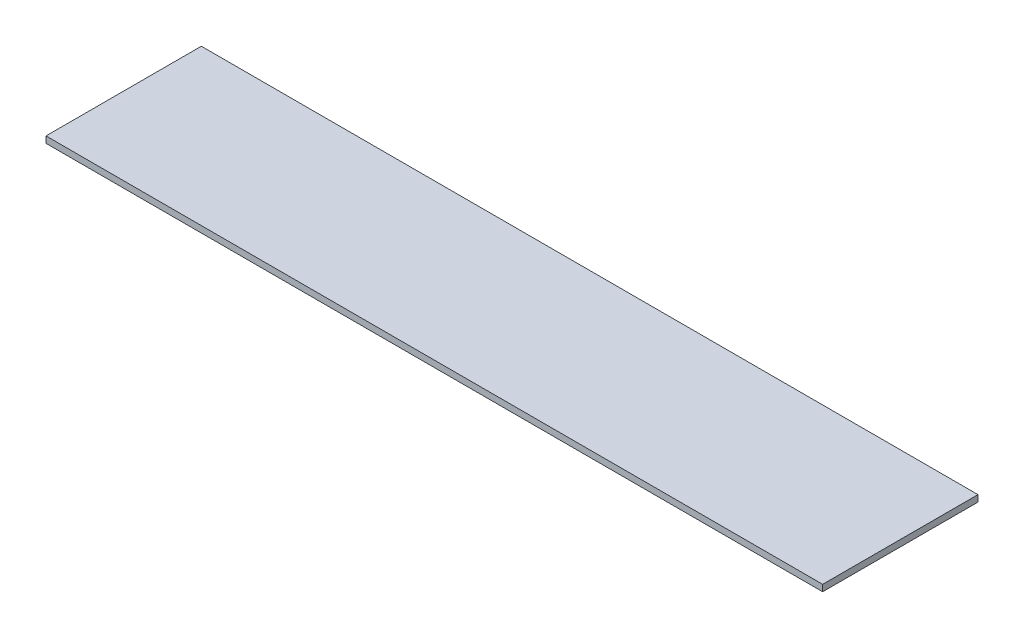
from build123d import *

# Parameters (mm, degrees)
SKETCH1_W           = 1524
SKETCH1_H           = 304.8
BOSS_EXTRUDE1_DEPTH = 12.7


with BuildPart() as part:
    # Sketch1 → Boss-Extrude1 (new body)
    with BuildSketch(Plane(origin=(0, 0, 0), x_dir=(1, 0, 0), z_dir=(0, 1, 0))):
        with Locations((-762, 152.4)):
            Rectangle(SKETCH1_W, SKETCH1_H)
    extrude(amount=BOSS_EXTRUDE1_DEPTH)


solid = part.part
